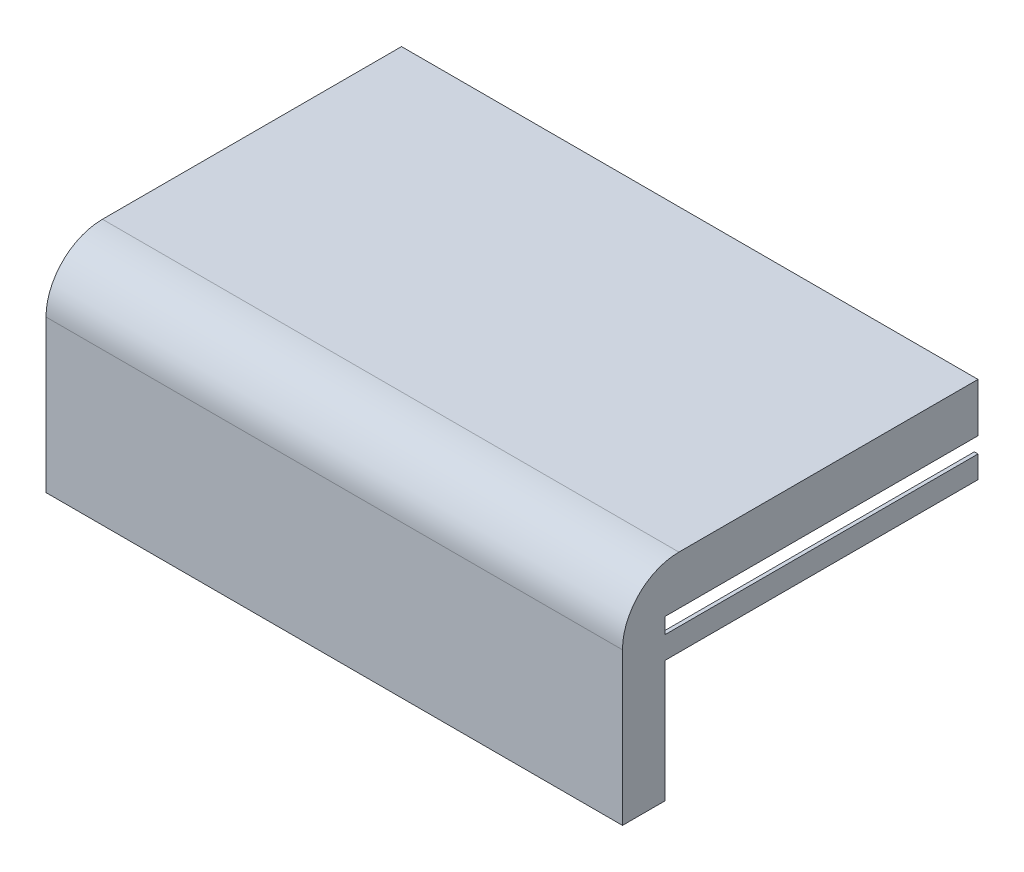
from build123d import *

# Parameters (mm, degrees)
SKETCH2_W           = 204.3
SKETCH2_H           = 73.9
BOSS_EXTRUDE1_DEPTH = 126
SKETCH3_W           = 111
SKETCH3_H           = 56.6
CUT_EXTRUDE2_DEPTH  = 274.3
FILLET1_R           = 20
SKETCH5_W           = 111
SKETCH5_H           = 7.907805674
BOSS_EXTRUDE4_DEPTH = 1.3


with BuildPart() as part:
    # Sketch2 → Boss-Extrude1 (new body)
    with BuildSketch(Plane.XY):
        with Locations((40.038337802, -14.066756032)):
            Rectangle(SKETCH2_W, SKETCH2_H)
    extrude(amount=BOSS_EXTRUDE1_DEPTH)

    # Sketch3 → Cut-Extrude2 (cut)
    with BuildSketch(Plane(origin=(142.188337802, 0, 0), x_dir=(0, 0, -1), z_dir=(1, 0, 0))):
        with Locations((-55.5, -22.716756032)):
            Rectangle(SKETCH3_W, SKETCH3_H)
    extrude(amount=-CUT_EXTRUDE2_DEPTH, mode=Mode.SUBTRACT)

    # Fillet1
    fillet1_edges = [part.edges().sort_by_distance(p)[0] for p in [
        (40.038337802, 22.883243968, 126),
    ]]
    fillet(fillet1_edges, radius=FILLET1_R)

    # Sketch5 → Boss-Extrude4 (add)
    with BuildSketch(Plane(origin=(142.188337802, 0, 0), x_dir=(0, 0, -1), z_dir=(1, 0, 0))):
        with Locations((-55.5, -3.953902837)):
            Rectangle(SKETCH5_W, SKETCH5_H)
    extrude(amount=-BOSS_EXTRUDE4_DEPTH)


solid = part.part
